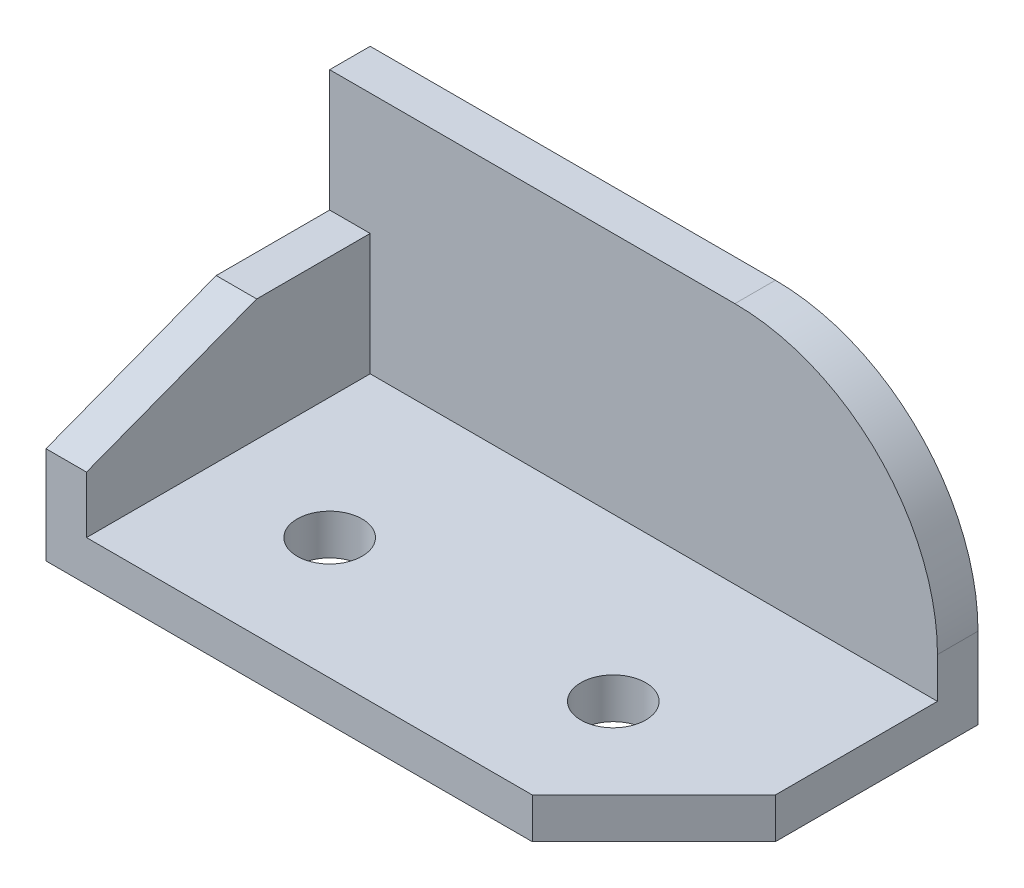
from build123d import *

# Parameters (mm, degrees)
SKETCH1_R           = 4
BOSS_EXTRUDE1_DEPTH = 5
BOSS_EXTRUDE2_DEPTH = 5
BOSS_EXTRUDE3_DEPTH = 5


with BuildPart() as part:
    # Sketch1 → Boss-Extrude1 (new body)
    with BuildSketch(Plane(origin=(0, 0, 0), x_dir=(1, 0, 0), z_dir=(0, 1, 0))):
        Polygon((0, 0), (75, 0), (75, -25), (60, -40), (0, -40), align=None)
        with Locations(Location((20, -25, 0), (0, 0, 270))):
            Circle(SKETCH1_R, mode=Mode.SUBTRACT)
        with Locations(Location((55, -25, 0), (0, 0, 270))):
            Circle(SKETCH1_R, mode=Mode.SUBTRACT)
    extrude(amount=BOSS_EXTRUDE1_DEPTH)

    # Sketch3 → Boss-Extrude2 (add)
    with BuildSketch(Plane(origin=(0, 0, 0), x_dir=(0, 0, -1), z_dir=(1, 0, 0))):
        Polygon((-40, 5), (-40, 12), (-19, 20), (0, 20), (0, 5), align=None)
    extrude(amount=BOSS_EXTRUDE2_DEPTH)

    # Sketch4 → Boss-Extrude3 (add)
    with BuildSketch(Plane.XY):
        with BuildLine():
            Line((0, 35), (0, 0))
            Line((0, 0), (75, 0))
            Line((75, 0), (75, 10))
            ThreePointArc((75, 10), (67.67766953, 27.67766953), (50, 35))
            Line((50, 35), (0, 35))
        make_face()
    extrude(amount=BOSS_EXTRUDE3_DEPTH)


solid = part.part
